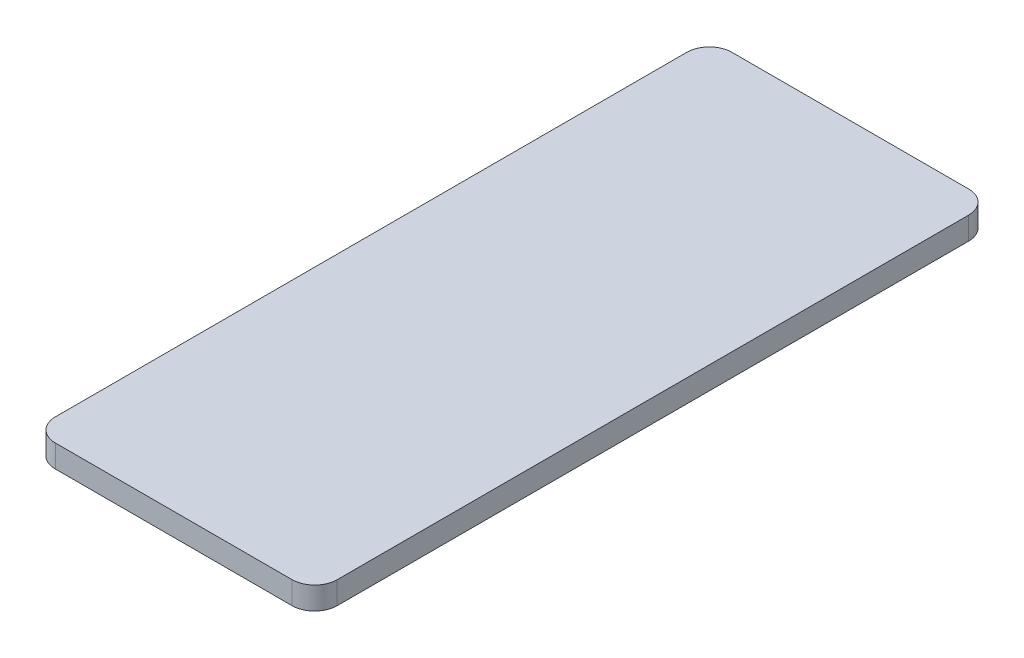
from build123d import *

# Parameters (mm, degrees)
SKETCH1_W           = 25
SKETCH1_H           = 60
BOSS_EXTRUDE1_DEPTH = 2
FILLET1_R           = 2


with BuildPart() as part:
    # Sketch1 → Boss-Extrude1 (new body)
    with BuildSketch(Plane(origin=(0, 0, 0), x_dir=(1, 0, 0), z_dir=(0, 1, 0))):
        Rectangle(SKETCH1_W, SKETCH1_H)
    extrude(amount=BOSS_EXTRUDE1_DEPTH)

    # Fillet1
    fillet1_edges = [part.edges().sort_by_distance(p)[0] for p in [
        (-12.5, 1, -30),
        (12.5, 1, -30),
        (12.5, 1, 30),
        (-12.5, 1, 30),
    ]]
    fillet(fillet1_edges, radius=FILLET1_R)


solid = part.part
